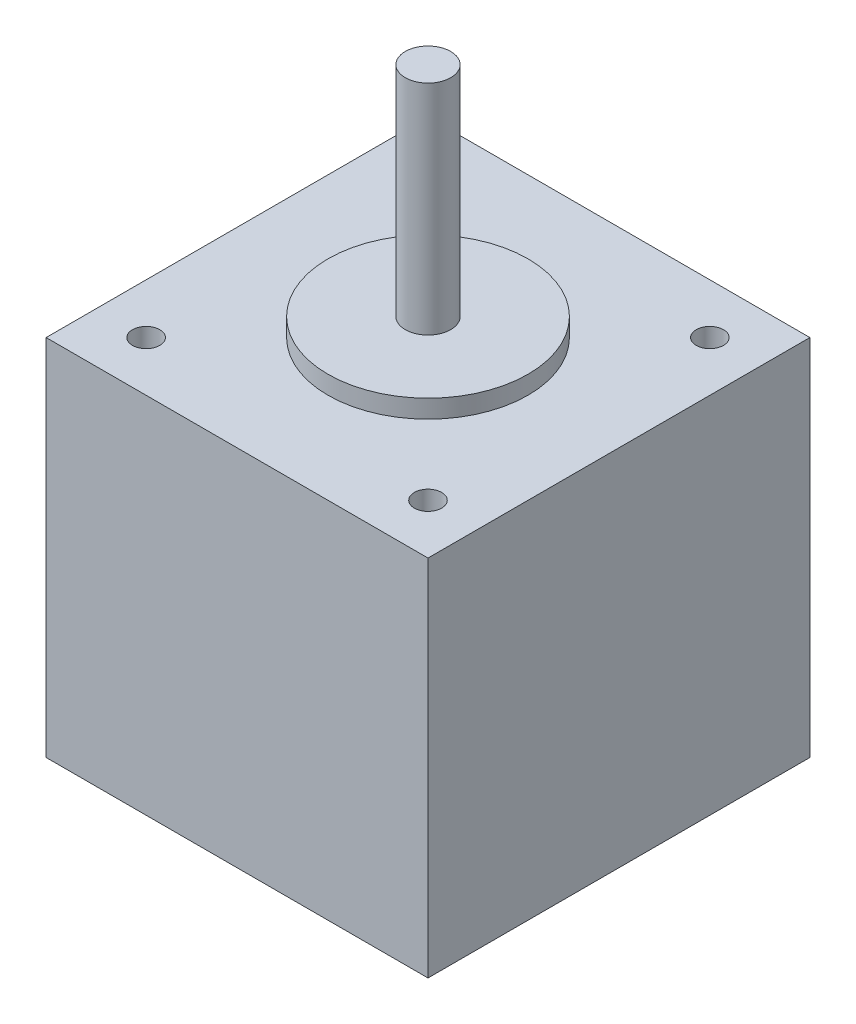
from build123d import *

# Parameters (mm, degrees)
SKETCH_1_W          = 42
SKETCH_1_H          = 42
EXTRUDE_1_DEPTH     = 40
SKETCH_3_R          = 1.5
CUT_EXTRUDE_1_DEPTH = 50.819674828
SKETCH_4_R          = 11
EXTRUDE_2_DEPTH     = 2
SKETCH_5_R          = 2.5
EXTRUDE_3_DEPTH     = 24


with BuildPart() as part:
    # 스케치1 → 보스-돌출1 (new body)
    with BuildSketch(Plane(origin=(0, 0, 0), x_dir=(1, 0, 0), z_dir=(0, 1, 0))):
        Rectangle(SKETCH_1_W, SKETCH_1_H)
    extrude(amount=EXTRUDE_1_DEPTH)

    # 스케치3 → 컷-돌출1 (cut, through all)
    with BuildSketch(Plane(origin=(0, 40, 0), x_dir=(1, 0, 0), z_dir=(0, 1, 0))):
        with Locations(Location((-15.5, 15.5, 0), (0, 0, 270))):
            Circle(SKETCH_3_R)
        with Locations(Location((15.5, 15.5, 0), (0, 0, 270))):
            Circle(SKETCH_3_R)
        with Locations(Location((15.5, -15.5, 0), (0, 0, 270))):
            Circle(SKETCH_3_R)
        with Locations(Location((-15.5, -15.5, 0), (0, 0, 270))):
            Circle(SKETCH_3_R)
    extrude(amount=-CUT_EXTRUDE_1_DEPTH, mode=Mode.SUBTRACT)

    # 스케치4 → 보스-돌출2 (add)
    with BuildSketch(Plane(origin=(0, 40, 0), x_dir=(1, 0, 0), z_dir=(0, 1, 0))):
        with Locations(Location((0, 0, 0), (0, 0, 90))):
            Circle(SKETCH_4_R)
    extrude(amount=EXTRUDE_2_DEPTH)

    # 스케치5 → 보스-돌출3 (add)
    with BuildSketch(Plane(origin=(0, 42, 0), x_dir=(1, 0, 0), z_dir=(0, 1, 0))):
        with Locations(Location((0, 0, 0), (0, 0, 270))):
            Circle(SKETCH_5_R)
    extrude(amount=EXTRUDE_3_DEPTH)


solid = part.part
